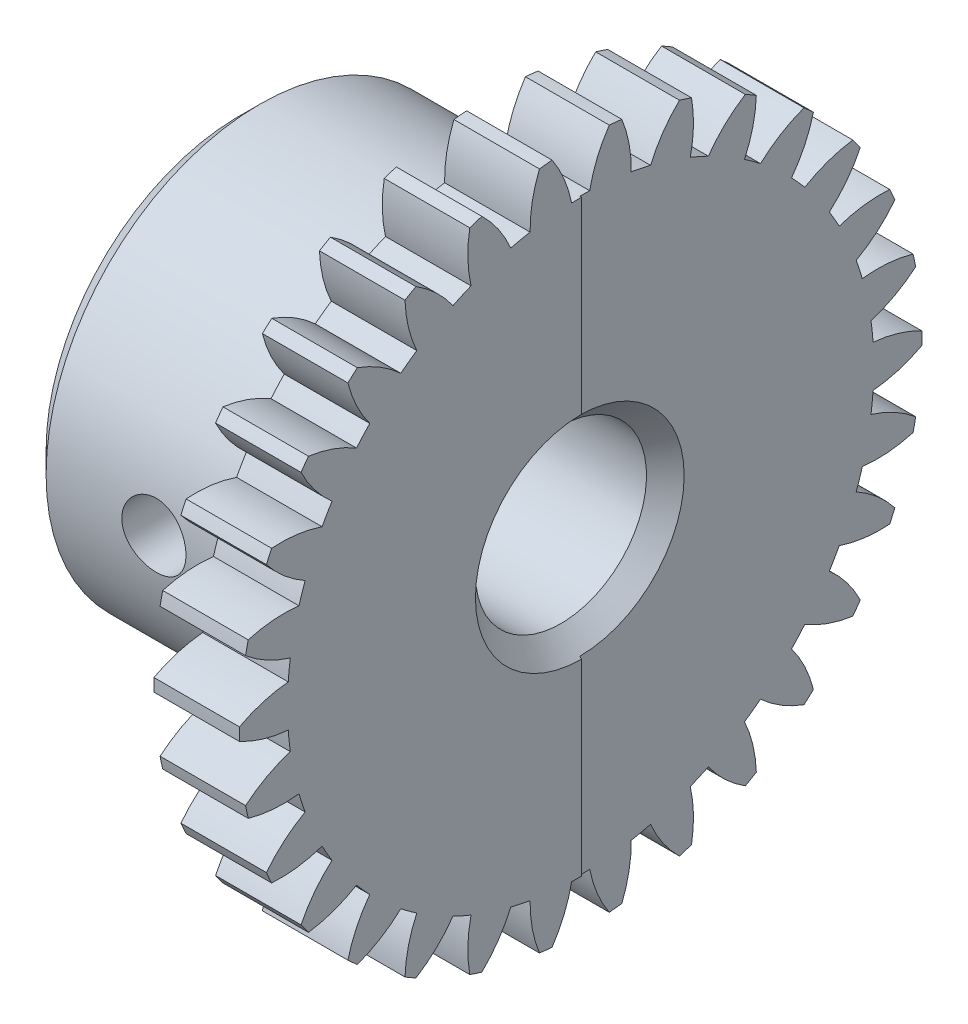
from build123d import *

# Parameters (mm, degrees)
BASPROSKE_W             = 6.35
BASPROSKE_H             = 25.4
TOOTHCUT_DEPTH          = 37.477972806
TEETHCUTS_COUNT         = 30
TEETHCUTS_ANGLE         = 348
HUBNEAONESKE_R          = 15.875
HUBNEARONE_DEPTH        = 19.0500508
BORSKE_R                = 6.35
BORE_DEPTH              = 25.4000508
CHAMFER1_SIZE           = 1.524
CHAMFER2_SIZE           = 1.524
CUT_EXTRUDE1_DEPTH      = 41.601023483
CUT_EXTRUDE1_DEPTH_BACK = 41.601023483
SKETCH1_R               = 2.38125
SKETCH2_W               = 32.229859927
SKETCH2_H               = 63.960998617
CUT_EXTRUDE2_DEPTH      = 0.127


with BuildPart() as part:
    # BasProSke → Base-Revolve (revolve)
    with BuildSketch(Plane(origin=(0, 0, 0), x_dir=(1, 0, 0), z_dir=(0, 1, 0)), mode=Mode.PRIVATE) as base_revolve_sk:
        with Locations((3.175, 12.7)):
            Rectangle(BASPROSKE_W, BASPROSKE_H)
    revolve(base_revolve_sk.sketch.rotate(Axis((-10, 0, 0), (1, 0, 0)), 180), axis=Axis((-10, 0, 0), (1, 0, 0)))

    # TooCutSke → ToothCut (cut, through all)
    with BuildSketch(Plane(origin=(0, 0, 0), x_dir=(0, 0, -1), z_dir=(1, 0, 0))):
        with BuildLine():
            ThreePointArc((0.735377359, 21.814463535), (0, 21.826855), (-0.735377359, 21.814463535))
            ThreePointArc((-0.735377359, 21.814463535), (-1.291625993, 23.646238568), (-2.202933256, 25.329785831))
            ThreePointArc((-2.202933256, 25.329785831), (0, 25.4254), (2.202933256, 25.329785831))
            ThreePointArc((2.202933256, 25.329785831), (1.291625993, 23.646238568), (0.735377359, 21.814463535))
        make_face()
    toothcut = extrude(amount=TOOTHCUT_DEPTH, mode=Mode.SUBTRACT)

    # TeethCuts: ToothCut ×30 about axis
    teethcuts_axis = Axis((-10, 0, 0), (1, 0, 0))
    for i in range(1, TEETHCUTS_COUNT):
        add(toothcut.rotate(teethcuts_axis, i * TEETHCUTS_ANGLE / (TEETHCUTS_COUNT - 1)), mode=Mode.SUBTRACT)

    # HubNeaOneSke → HubNearOne (add)
    with BuildSketch(Plane.ZY):
        with Locations(Location((0, 0, 0), (0, 0, 180))):
            Circle(HUBNEAONESKE_R)
    extrude(amount=HUBNEARONE_DEPTH)

    # BorSke → Bore (cut, symmetric)
    with BuildSketch(Plane(origin=(0, 0, 0), x_dir=(0, 0, -1), z_dir=(1, 0, 0))):
        with Locations(Location((0, 0, 0), (0, 0, 180))):
            Circle(BORSKE_R)
    extrude(amount=BORE_DEPTH, both=True, mode=Mode.SUBTRACT)

    # Chamfer1
    chamfer1_edges = [part.edges().sort_by_distance(p)[0] for p in [
        (0, 0, 15.875),
        (-19.0500508, 0, 15.875),
    ]]
    chamfer(chamfer1_edges, length=CHAMFER1_SIZE)

    # Chamfer2
    chamfer2_edges = [part.edges().sort_by_distance(p)[0] for p in [
        (-19.0500508, 0, -6.35),
        (6.35, 0, -6.35),
    ]]
    chamfer(chamfer2_edges, length=CHAMFER2_SIZE)

    # Sketch1 → Cut-Extrude1 (cut, two sides: drawn at the far end of the back side and taken through both)
    with BuildSketch(Plane.XY.offset(-CUT_EXTRUDE1_DEPTH_BACK)):
        with Locations((-9.5250254, 0)):
            Circle(SKETCH1_R)
    extrude(amount=CUT_EXTRUDE1_DEPTH + CUT_EXTRUDE1_DEPTH_BACK, mode=Mode.SUBTRACT)

    # Sketch2 → Cut-Extrude2 (cut)
    with BuildSketch(Plane(origin=(6.35, 0, 0), x_dir=(0, 0, -1), z_dir=(1, 0, 0))):
        with Locations((16.114929963, 2.992327421)):
            Rectangle(SKETCH2_W, SKETCH2_H)
    extrude(amount=-CUT_EXTRUDE2_DEPTH, mode=Mode.SUBTRACT)


solid = part.part
